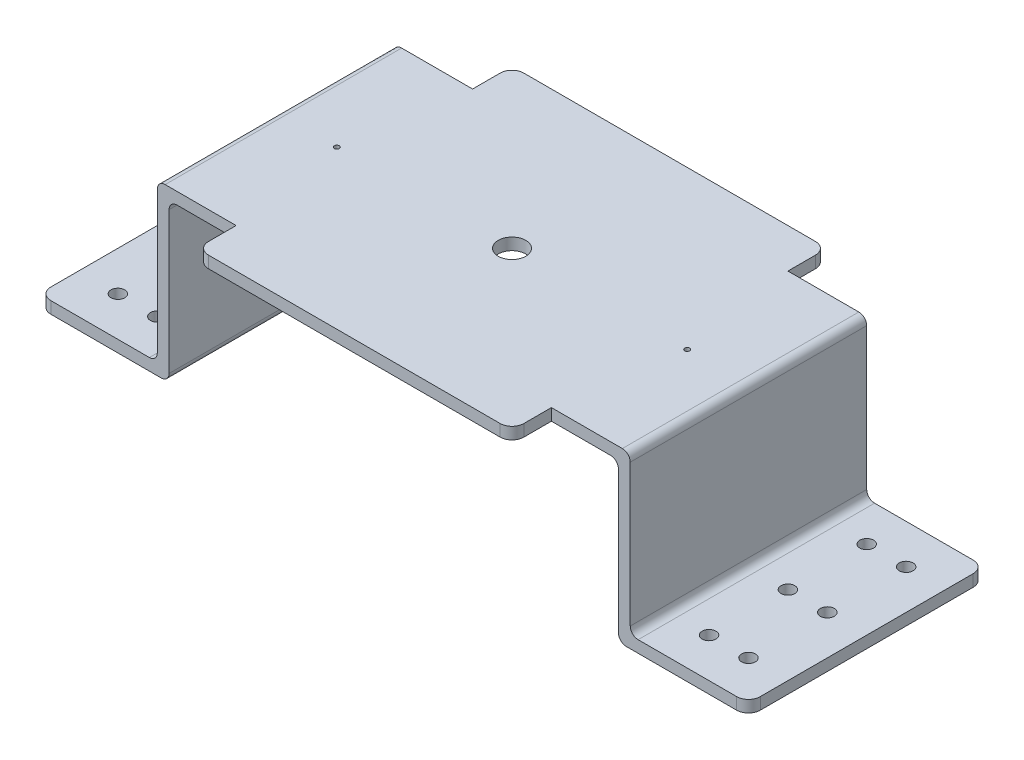
from build123d import *

# Parameters (mm, degrees)
SKETCH_1_W                  = 120
SKETCH_1_H                  = 60
EXTRUDE_1_DEPTH             = 3
SKETCH_2_W                  = 3
SKETCH_2_H                  = 60
EXTRUDE_2_DEPTH             = 40
SKETCH_3_W                  = 60
SKETCH_3_H                  = 3
EXTRUDE_3_DEPTH             = 30
SKETCH_4_R                  = 1.75
CUT_EXTRUDE_1_DEPTH         = 3
PATTERN_LINEAR_1_COUNT      = 3
PATTERN_LINEAR_1_PITCH      = 20
PATTERN_LINEAR_1_COUNT_DIR2 = 2
PATTERN_LINEAR_1_PITCH_DIR2 = 10
MIRROR_1_COPY_1_SKETCH_R    = 1.75
MIRROR_1_COPY_1_DEPTH       = 3
MIRROR_1_COPY_2_SKETCH_R    = 1.75
MIRROR_1_COPY_2_DEPTH       = 3
MIRROR_1_COPY_3_SKETCH_R    = 1.75
MIRROR_1_COPY_3_DEPTH       = 3
MIRROR_1_COPY_4_SKETCH_R    = 1.75
MIRROR_1_COPY_4_DEPTH       = 3
MIRROR_1_COPY_5_SKETCH_R    = 1.75
MIRROR_1_COPY_5_DEPTH       = 3
SKETCH_5_R                  = 3.5
CUT_EXTRUDE_2_DEPTH         = 3
SKETCH_6_R                  = 0.5
CUT_EXTRUDE_3_DEPTH         = 3
SKETCH_7_W                  = 80
SKETCH_7_H                  = 10
EXTRUDE_4_DEPTH             = 3
FILLET_1_R                  = 3
FILLET_2_R                  = 3
HOLE_WIZARD_M1_6_1_D        = 1.25
FILLET_3_R                  = 2
FILLET_4_R                  = 2
FILLET_5_R                  = 3


with BuildPart() as part:
    # 草图1 → 凸台-拉伸1 (new body)
    with BuildSketch(Plane(origin=(0, 0, 0), x_dir=(1, 0, 0), z_dir=(0, 1, 0))):
        Rectangle(SKETCH_1_W, SKETCH_1_H)
    extrude(amount=EXTRUDE_1_DEPTH)

    # 草图2 → 凸台-拉伸2 (add)
    with BuildSketch(Plane.XZ):
        with Locations((-58.5, 0)):
            Rectangle(SKETCH_2_W, SKETCH_2_H)
    extrude_2 = extrude(amount=EXTRUDE_2_DEPTH)

    # 草图3 → 凸台-拉伸3 (add)
    with BuildSketch(Plane.ZY.offset(60)):
        with Locations((0, -38.5)):
            Rectangle(SKETCH_3_W, SKETCH_3_H)
    extrude_3 = extrude(amount=EXTRUDE_3_DEPTH)

    # 草图4 → 切除-拉伸1 (cut)
    with BuildSketch(Plane(origin=(0, -37, 0), x_dir=(1, 0, 0), z_dir=(0, 1, 0))):
        with Locations(Location((-70, -20, 0), (0, 0, 270))):
            Circle(SKETCH_4_R)
    cut_extrude_1 = extrude(amount=-CUT_EXTRUDE_1_DEPTH, mode=Mode.SUBTRACT)

    # 阵列(线性)1: Cut-Extrude 1 3 × 2
    with Locations(*[(-j * PATTERN_LINEAR_1_PITCH_DIR2, 0, -i * PATTERN_LINEAR_1_PITCH) for i in range(PATTERN_LINEAR_1_COUNT) for j in range(PATTERN_LINEAR_1_COUNT_DIR2) if (i, j) != (0, 0)]):
        add(cut_extrude_1, mode=Mode.SUBTRACT)

    # 镜向1: 凸台-拉伸2, 凸台-拉伸3, 切除-拉伸1 across plane
    add(extrude_2.mirror(Plane(origin=(0, 0, 0), x_dir=(0, 0, 1), z_dir=(1, 0, 0))))
    add(extrude_3.mirror(Plane(origin=(0, 0, 0), x_dir=(0, 0, 1), z_dir=(1, 0, 0))))
    add(cut_extrude_1.mirror(Plane(origin=(0, 0, 0), x_dir=(0, 0, 1), z_dir=(1, 0, 0))), mode=Mode.SUBTRACT)

    # 镜向1 copy 1 sketch → 镜向1 copy 1 (cut)
    with BuildSketch(Plane(origin=(10, -37, 0), x_dir=(-1, 0, 0), z_dir=(0, 1, 0))):
        with Locations((-70, 20)):
            Circle(MIRROR_1_COPY_1_SKETCH_R)
    extrude(amount=-MIRROR_1_COPY_1_DEPTH, mode=Mode.SUBTRACT)

    # 镜向1 copy 2 sketch → 镜向1 copy 2 (cut)
    with BuildSketch(Plane(origin=(0, -37, -20), x_dir=(-1, 0, 0), z_dir=(0, 1, 0))):
        with Locations((-70, 20)):
            Circle(MIRROR_1_COPY_2_SKETCH_R)
    extrude(amount=-MIRROR_1_COPY_2_DEPTH, mode=Mode.SUBTRACT)

    # 镜向1 copy 3 sketch → 镜向1 copy 3 (cut)
    with BuildSketch(Plane(origin=(10, -37, -20), x_dir=(-1, 0, 0), z_dir=(0, 1, 0))):
        with Locations((-70, 20)):
            Circle(MIRROR_1_COPY_3_SKETCH_R)
    extrude(amount=-MIRROR_1_COPY_3_DEPTH, mode=Mode.SUBTRACT)

    # 镜向1 copy 4 sketch → 镜向1 copy 4 (cut)
    with BuildSketch(Plane(origin=(0, -37, -40), x_dir=(-1, 0, 0), z_dir=(0, 1, 0))):
        with Locations((-70, 20)):
            Circle(MIRROR_1_COPY_4_SKETCH_R)
    extrude(amount=-MIRROR_1_COPY_4_DEPTH, mode=Mode.SUBTRACT)

    # 镜向1 copy 5 sketch → 镜向1 copy 5 (cut)
    with BuildSketch(Plane(origin=(10, -37, -40), x_dir=(-1, 0, 0), z_dir=(0, 1, 0))):
        with Locations((-70, 20)):
            Circle(MIRROR_1_COPY_5_SKETCH_R)
    extrude(amount=-MIRROR_1_COPY_5_DEPTH, mode=Mode.SUBTRACT)

    # 草图5 → 切除-拉伸2 (cut)
    with BuildSketch(Plane(origin=(0, 3, 0), x_dir=(1, 0, 0), z_dir=(0, 1, 0))):
        with Locations(Location((0, 0, 0), (0, 0, 270))):
            Circle(SKETCH_5_R)
    extrude(amount=-CUT_EXTRUDE_2_DEPTH, mode=Mode.SUBTRACT)

    # 草图6 → 切除-拉伸3 (cut)
    with BuildSketch(Plane(origin=(0, 3, 0), x_dir=(1, 0, 0), z_dir=(0, 1, 0))):
        with Locations(Location((44.45, 0, 0), (0, 0, 270))):
            Circle(SKETCH_6_R)
    cut_extrude_3 = extrude(amount=-CUT_EXTRUDE_3_DEPTH, mode=Mode.SUBTRACT)

    # 镜向2: 切除-拉伸3 across plane
    add(cut_extrude_3.mirror(Plane(origin=(0, 0, 0), x_dir=(0, 0, 1), z_dir=(1, 0, 0))), mode=Mode.SUBTRACT)

    # 草图7 → 凸台-拉伸4 (add)
    with BuildSketch(Plane(origin=(0, 3, 0), x_dir=(1, 0, 0), z_dir=(0, 1, 0))):
        with Locations((0, 35)):
            Rectangle(SKETCH_7_W, SKETCH_7_H)
    extrude_4 = extrude(amount=-EXTRUDE_4_DEPTH)

    # 镜向3: 凸台-拉伸4 across plane
    add(extrude_4.mirror(Plane.XY))

    # 圆角1
    fillet_1_edges = [part.edges().sort_by_distance(p)[0] for p in [
        (-40, 1.5, 40),
    ]]
    fillet(fillet_1_edges, radius=FILLET_1_R)

    # 圆角2
    fillet_2_edges = [part.edges().sort_by_distance(p)[0] for p in [
        (-40, 1.5, -40),
        (40, 1.5, -40),
        (40, 1.5, 40),
    ]]
    fillet(fillet_2_edges, radius=FILLET_2_R)

    # M1.6 螺纹孔1 (through all)
    with Locations(Plane(origin=(0, 3, 0), x_dir=(1, 0, 0), z_dir=(0, 1, 0))):
        with Locations((44.45, 0), (-44.45, 0)):
            Hole(HOLE_WIZARD_M1_6_1_D / 2)

    # 圆角3
    fillet_3_edges = [part.edges().sort_by_distance(p)[0] for p in [
        (-57, 0, 0),
        (-60, 3, 0),
    ]]
    fillet(fillet_3_edges, radius=FILLET_3_R)

    # 圆角4
    fillet_4_edges = [part.edges().sort_by_distance(p)[0] for p in [
        (60, 3, 0),
        (-57, -40, 0),
        (-60, -37, 0),
        (57, -40, 0),
        (57, 0, 0),
        (60, -37, 0),
    ]]
    fillet(fillet_4_edges, radius=FILLET_4_R)

    # 圆角5
    fillet_5_edges = [part.edges().sort_by_distance(p)[0] for p in [
        (-90, -38.5, -30),
        (-90, -38.5, 30),
        (90, -38.5, -30),
        (90, -38.5, 30),
    ]]
    fillet(fillet_5_edges, radius=FILLET_5_R)


solid = part.part
